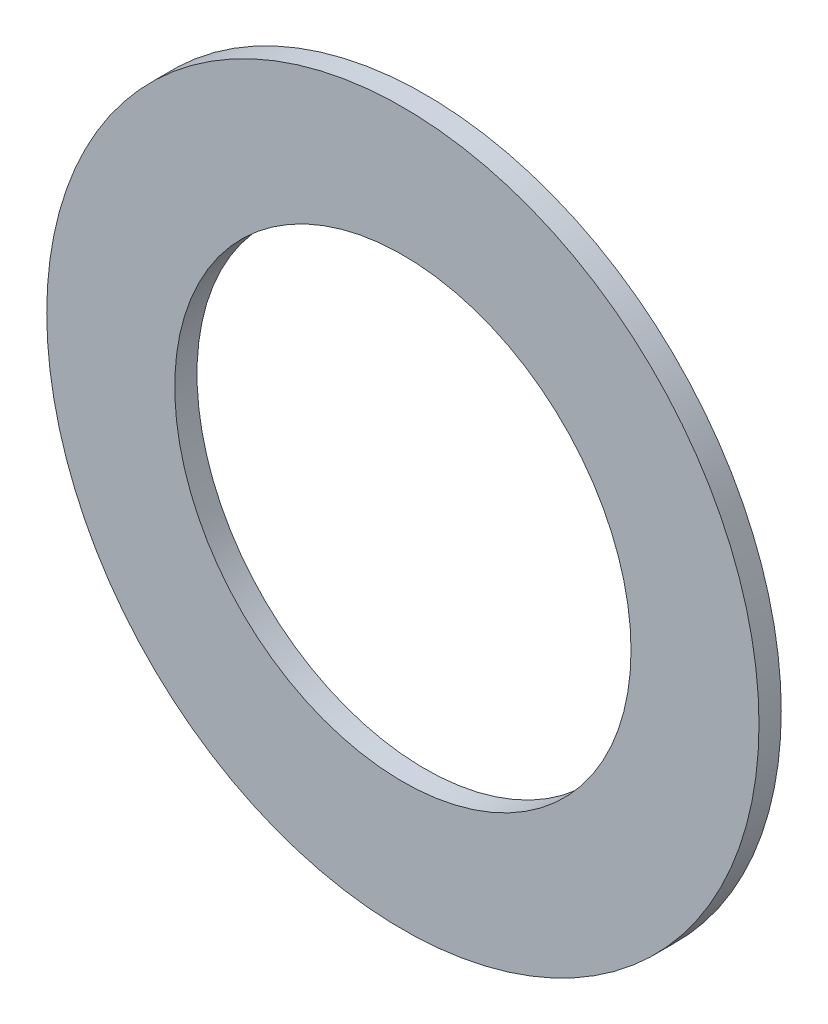
from build123d import *

# Parameters (mm, degrees)
SKETCH1_R           = 16
SKETCH1_R_2         = 10.25
BOSS_EXTRUDE1_DEPTH = 1


with BuildPart() as part:
    # Sketch1 → Boss-Extrude1 (new body)
    with BuildSketch(Plane.XY):
        Circle(SKETCH1_R)
        Circle(SKETCH1_R_2, mode=Mode.SUBTRACT)
    extrude(amount=BOSS_EXTRUDE1_DEPTH)


solid = part.part
